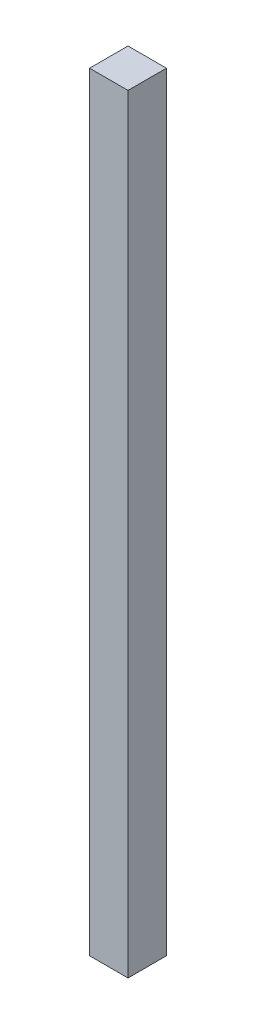
from build123d import *

# Parameters (mm, degrees)
SKETCH1_W           = 20
SKETCH1_H           = 20
BOSS_EXTRUDE1_DEPTH = 400


with BuildPart() as part:
    # Sketch1 → Boss-Extrude1 (new body)
    with BuildSketch(Plane(origin=(0, 0, 0), x_dir=(1, 0, 0), z_dir=(0, 1, 0))):
        with Locations((10, -10)):
            Rectangle(SKETCH1_W, SKETCH1_H)
    extrude(amount=BOSS_EXTRUDE1_DEPTH)


solid = part.part
